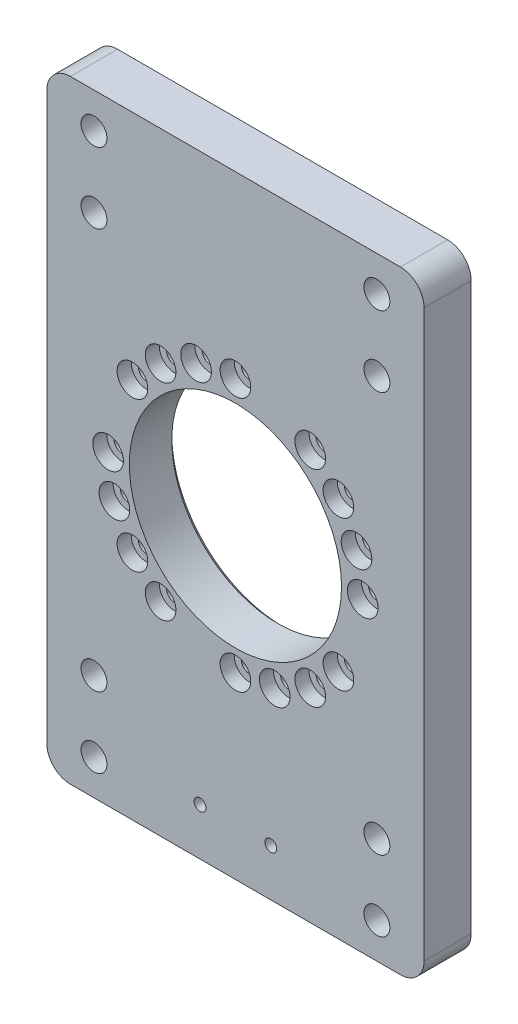
from build123d import *

# Parameters (mm, degrees)
SKETCH1_W                                           = 80
SKETCH1_H                                           = 130
SKETCH1_R                                           = 22.5
BOSS_EXTRUDE1_DEPTH                                 = 10
CBORE_FOR_M3_HEX_SOCKET_HEAD_CAP_SCREW1_D           = 3.5
CBORE_FOR_M3_HEX_SOCKET_HEAD_CAP_SCREW1_CBORE_D     = 6.5
CBORE_FOR_M3_HEX_SOCKET_HEAD_CAP_SCREW1_CBORE_DEPTH = 3
CHAMFER1_SIZE                                       = 1
F_5_5_5_5_DIAMETER_HOLE1_D                          = 5.5
FILLET1_R                                           = 5
M3_TAPPED_HOLE1_D                                   = 2.5


with BuildPart() as part:
    # Sketch1 → Boss-Extrude1 (new body)
    with BuildSketch(Plane.XY):
        Rectangle(SKETCH1_W, SKETCH1_H)
        Circle(SKETCH1_R, mode=Mode.SUBTRACT)
    extrude(amount=BOSS_EXTRUDE1_DEPTH)

    # CBORE for M3 Hex Socket Head Cap Screw1 (through all)
    with Locations(Plane.XY.offset(10)):
        with Locations((-27, 0), (-25.67852594, -8.343458848), (-21.843458848, -15.870201812), (-15.870201812, -21.843458848), (27, 0), (25.67852594, 8.343458848), (21.843458848, 15.870201812), (15.870201812, 21.843458848), (0, 27), (-8.343458848, 25.67852594), (-15.870201812, 21.843458848), (-21.843458848, 15.870201812), (0, -27), (8.343458848, -25.67852594), (15.870201812, -21.843458848), (21.843458848, -15.870201812)):
            CounterBoreHole(CBORE_FOR_M3_HEX_SOCKET_HEAD_CAP_SCREW1_D / 2, CBORE_FOR_M3_HEX_SOCKET_HEAD_CAP_SCREW1_CBORE_D / 2, CBORE_FOR_M3_HEX_SOCKET_HEAD_CAP_SCREW1_CBORE_DEPTH)

    # Chamfer1
    chamfer1_edges = [part.edges().sort_by_distance(p)[0] for p in [
        (-22.5, 0, 0),
    ]]
    chamfer(chamfer1_edges, length=CHAMFER1_SIZE)

    # Ø5.5 (5.5) Diameter Hole1 (through all)
    with Locations(Plane.XY.offset(10)):
        with Locations((-30, 57.5), (30, 57.5), (30, -57.5), (-30, -57.5), (-30, -42.5), (-30, 42.5), (30, 42.5), (30, -42.5)):
            Hole(F_5_5_5_5_DIAMETER_HOLE1_D / 2)

    # Fillet1
    fillet1_edges = [part.edges().sort_by_distance(p)[0] for p in [
        (-40, 65, 5),
        (40, 65, 5),
        (40, -65, 5),
        (-40, -65, 5),
    ]]
    fillet(fillet1_edges, radius=FILLET1_R)

    # M3 Tapped Hole1 (through all)
    with Locations(Plane(origin=(0, 0, 0), x_dir=(-1, 0, 0), z_dir=(0, 0, -1))):
        with Locations((-7.5, -55), (7.5, -55)):
            Hole(M3_TAPPED_HOLE1_D / 2)


solid = part.part
